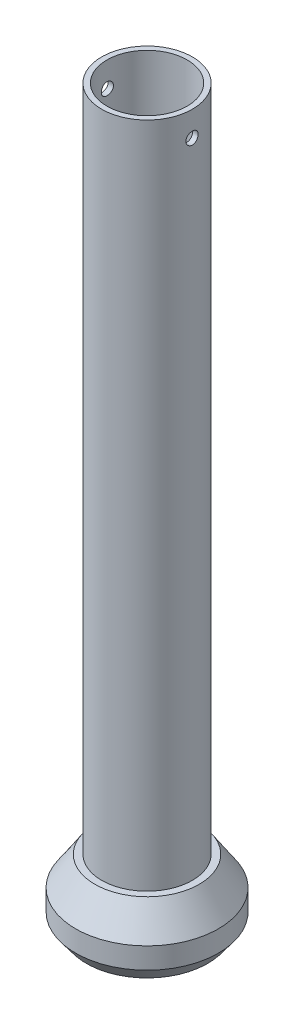
from build123d import *

# Parameters (mm, degrees)
SKETCH1_R               = 12.7
SKETCH1_R_2             = 11.227
BOSS_EXTRUDE1_DEPTH     = 205
CUT_EXTRUDE1_DEPTH      = 207.942020866
CUT_EXTRUDE1_DEPTH_BACK = 207.942020866
SKETCH3_R               = 1.7


with BuildPart() as part:
    # Sketch1 → Boss-Extrude1 (new body)
    with BuildSketch(Plane(origin=(0, 0, 0), x_dir=(1, 0, 0), z_dir=(0, 1, 0))):
        with Locations(Location((0, 0, 0), (0, 0, 90))):
            Circle(SKETCH1_R)
        with Locations(Location((0, 0, 0), (0, 0, 90))):
            Circle(SKETCH1_R_2, mode=Mode.SUBTRACT)
    extrude(amount=BOSS_EXTRUDE1_DEPTH)

    # Sketch2 → Revolve1 (revolve)
    with BuildSketch(Plane.XY, mode=Mode.PRIVATE) as revolve1_sk:
        Polygon((0, 0), (17, 0), (20, 4), (20, 9.9), (14.605, 18), (0, 18), align=None)
    revolve(revolve1_sk.sketch.rotate(Axis((0, -10, 0), (0, 1, 0)), 90), axis=Axis((0, -10, 0), (0, 1, 0)))

    # Sketch3 → Cut-Extrude1 (cut, two sides: drawn at the far end of the back side and taken through both)
    with BuildSketch(Plane(origin=(0, 0, 0), x_dir=(0, 0, -1), z_dir=(1, 0, 0)).offset(-CUT_EXTRUDE1_DEPTH_BACK)):
        with Locations((0, 198)):
            Circle(SKETCH3_R)
    extrude(amount=CUT_EXTRUDE1_DEPTH + CUT_EXTRUDE1_DEPTH_BACK, mode=Mode.SUBTRACT)


solid = part.part
